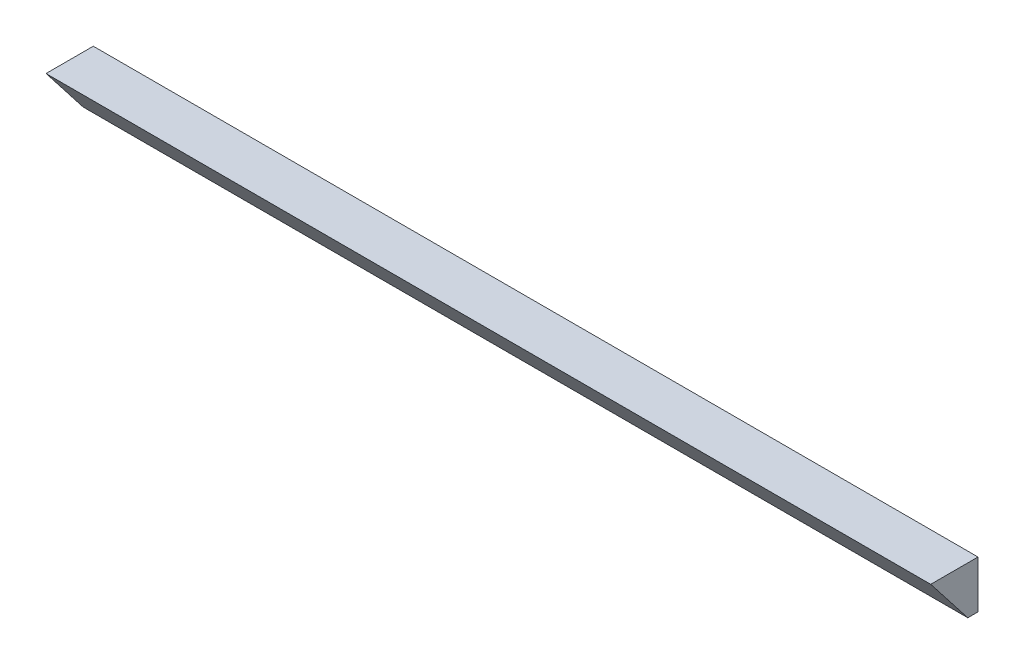
from build123d import *

# Parameters (mm, degrees)
RESSALTO_EXTRUS_O16_DEPTH = 93


with BuildPart() as part:
    # Esboço61 → Ressalto-extrusão16 (new body)
    with BuildSketch(Plane.ZY.offset(-55.189074272)):
        Polygon((38, -40.364497041), (38, -35.364497041), (42.971111087, -35.364497041), (39.07029207, -40.364497041), align=None)
    extrude(amount=RESSALTO_EXTRUS_O16_DEPTH)


solid = part.part
